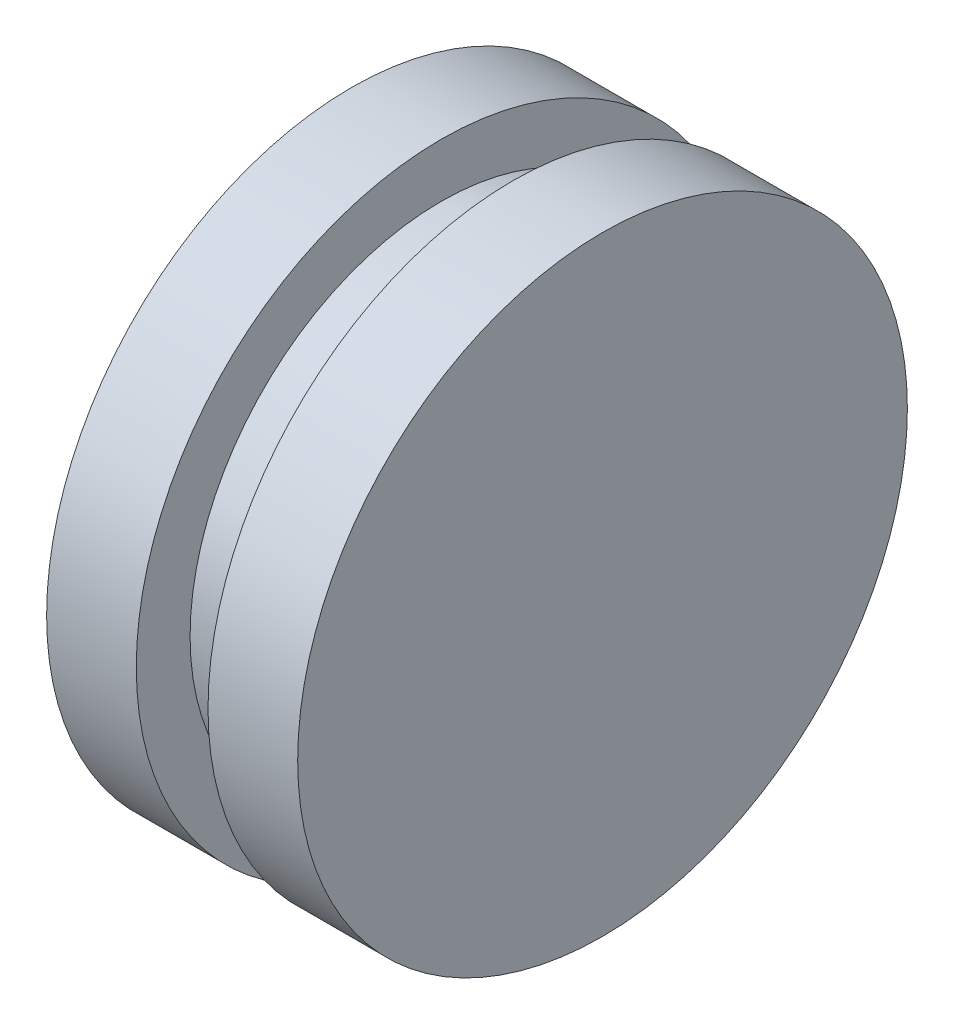
from build123d import *


with BuildPart() as part:
    # Sketch1 → Revolve1 (revolve)
    with BuildSketch(Plane.XY, mode=Mode.PRIVATE) as revolve1_sk:
        Polygon((0, 0), (0, -17), (5, -17), (5, -14), (9, -14), (9, -17), (14, -17), (14, 0), align=None)
    revolve(revolve1_sk.sketch.rotate(Axis((14, 0, 0), (-1, 0, 0)), 270), axis=Axis((14, 0, 0), (-1, 0, 0)))


solid = part.part
